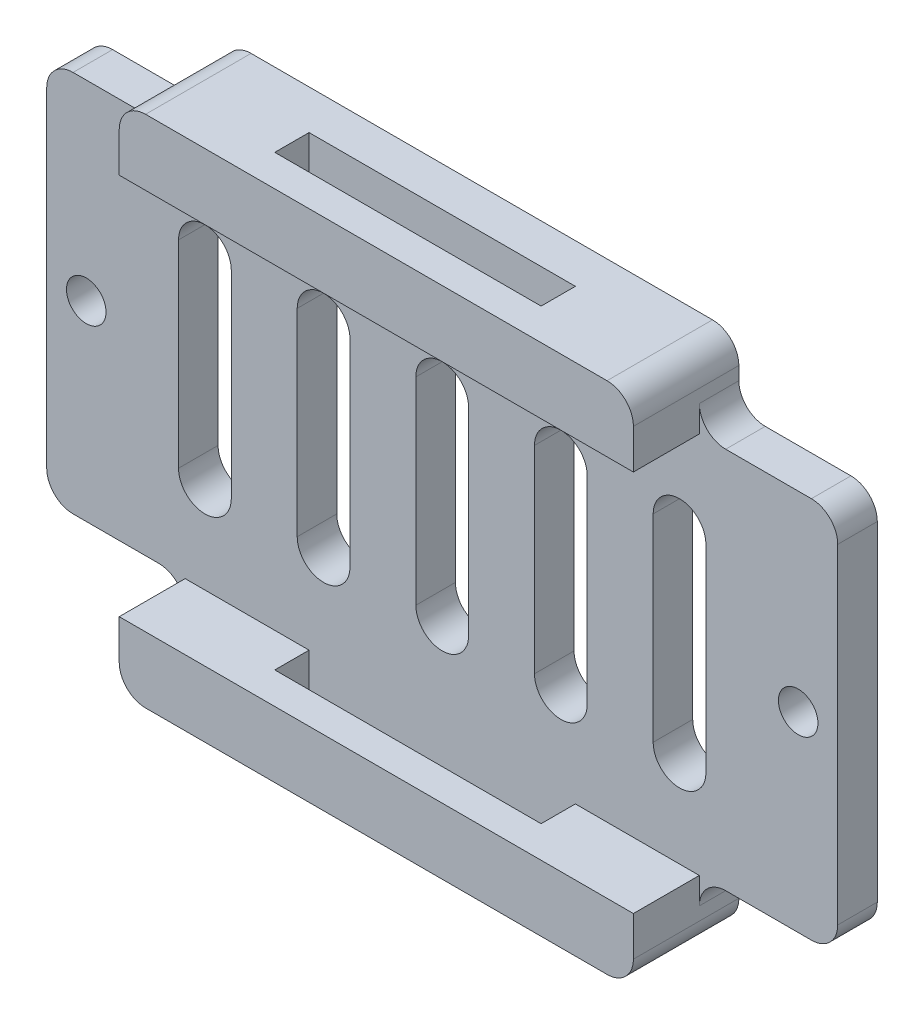
from build123d import *

# Parameters (mm, degrees)
SKETCH_2_W          = 39
SKETCH_2_H          = 5
EXTRUDE_1_DEPTH     = 8
SKETCH_3_W          = 60
SKETCH_3_H          = 3
EXTRUDE_2_DEPTH     = 29
SKETCH_4_W          = 20.2
SKETCH_4_H          = 2.6
CUT_EXTRUDE_1_DEPTH = 47.043457733
SKETCH_5_R          = 1.5
CUT_EXTRUDE_2_DEPTH = 10
FILLET_1_R          = 2
FILLET_2_R          = 2
SKETCH_6_W          = 39
SKETCH_6_H          = 3
EXTRUDE_3_DEPTH     = 5
SKETCH_7_W          = 39
SKETCH_7_H          = 5
EXTRUDE_4_DEPTH     = 5
SKETCH_8_W          = 20.2
SKETCH_8_H          = 2.6
CUT_EXTRUDE_3_DEPTH = 5
FILLET_3_R          = 2
CUT_EXTRUDE_4_DEPTH = 5


with BuildPart() as part:
    # 草图2 → 凸台-拉伸1 (new body)
    with BuildSketch(Plane.XY):
        Rectangle(SKETCH_2_W, SKETCH_2_H)
    extrude(amount=EXTRUDE_1_DEPTH)

    # 草图3 → 凸台-拉伸2 (add)
    with BuildSketch(Plane(origin=(0, 2.5, 0), x_dir=(1, 0, 0), z_dir=(0, 1, 0))):
        with Locations((0, -1.5)):
            Rectangle(SKETCH_3_W, SKETCH_3_H)
    extrude(amount=EXTRUDE_2_DEPTH)

    # 草图4 → 切除-拉伸1 (cut, through all)
    with BuildSketch(Plane.XZ.offset(2.5)):
        with Locations((0, 4.3)):
            Rectangle(SKETCH_4_W, SKETCH_4_H)
    extrude(amount=-CUT_EXTRUDE_1_DEPTH, mode=Mode.SUBTRACT)

    # 草图5 → 切除-拉伸2 (cut)
    with BuildSketch(Plane(origin=(0, 0, 0), x_dir=(-1, 0, 0), z_dir=(0, 0, -1))):
        with Locations((-27, 17)):
            Circle(SKETCH_5_R)
        with Locations((27, 17)):
            Circle(SKETCH_5_R)
    extrude(amount=-CUT_EXTRUDE_2_DEPTH, mode=Mode.SUBTRACT)

    # 圆角1
    fillet_1_edges = [part.edges().sort_by_distance(p)[0] for p in [
        (-30, 2.5, 1.5),
        (30, 2.5, 1.5),
        (-30, 31.5, 1.5),
        (30, 31.5, 1.5),
        (19.5, -2.5, 4),
        (-19.5, -2.5, 4),
    ]]
    fillet(fillet_1_edges, radius=FILLET_1_R)

    # 圆角2
    fillet_2_edges = [part.edges().sort_by_distance(p)[0] for p in [
        (-19.5, 2.5, 1.5),
        (19.5, 2.5, 1.5),
    ]]
    fillet(fillet_2_edges, radius=FILLET_2_R)

    # 草图6 → 凸台-拉伸3 (add)
    with BuildSketch(Plane(origin=(0, 31.5, 0), x_dir=(1, 0, 0), z_dir=(0, 1, 0))):
        with Locations((0, -1.5)):
            Rectangle(SKETCH_6_W, SKETCH_6_H)
    extrude(amount=EXTRUDE_3_DEPTH)

    # 草图7 → 凸台-拉伸4 (add)
    with BuildSketch(Plane.XY.offset(3)):
        with Locations((0, 34)):
            Rectangle(SKETCH_7_W, SKETCH_7_H)
    extrude(amount=EXTRUDE_4_DEPTH)

    # 草图8 → 切除-拉伸3 (cut)
    with BuildSketch(Plane(origin=(0, 36.5, 0), x_dir=(1, 0, 0), z_dir=(0, 1, 0))):
        with Locations((0, -4.3)):
            Rectangle(SKETCH_8_W, SKETCH_8_H)
    extrude(amount=-CUT_EXTRUDE_3_DEPTH, mode=Mode.SUBTRACT)

    # 圆角3
    fillet_3_edges = [part.edges().sort_by_distance(p)[0] for p in [
        (-19.5, 31.5, 1.5),
        (19.5, 31.5, 1.5),
        (-19.5, 36.5, 4),
        (19.5, 36.5, 4),
    ]]
    fillet(fillet_3_edges, radius=FILLET_3_R)

    # 草图9 → 切除-拉伸4 (cut)
    with BuildSketch(Plane(origin=(0, 0, 0), x_dir=(-1, 0, 0), z_dir=(0, 0, -1))):
        with BuildLine():
            Line((2, 24.5), (2, 9.5))
            ThreePointArc((2, 9.5), (0, 7.5), (-2, 9.5))
            Line((-2, 9.5), (-2, 24.5))
            ThreePointArc((-2, 24.5), (0, 26.5), (2, 24.5))
        make_face()
        with BuildLine():
            Line((7, 24.5), (7, 9.5))
            ThreePointArc((7, 9.5), (9, 7.5), (11, 9.5))
            Line((11, 9.5), (11, 24.5))
            ThreePointArc((11, 24.5), (9, 26.5), (7, 24.5))
        make_face()
        with BuildLine():
            Line((16, 24.5), (16, 9.5))
            ThreePointArc((16, 9.5), (18, 7.5), (20, 9.5))
            Line((20, 9.5), (20, 24.5))
            ThreePointArc((20, 24.5), (18, 26.5), (16, 24.5))
        make_face()
        with BuildLine():
            Line((-11, 24.5), (-11, 9.5))
            ThreePointArc((-11, 9.5), (-9, 7.5), (-7, 9.5))
            Line((-7, 9.5), (-7, 24.5))
            ThreePointArc((-7, 24.5), (-9, 26.5), (-11, 24.5))
        make_face()
        with BuildLine():
            Line((-20, 24.5), (-20, 9.5))
            ThreePointArc((-20, 9.5), (-18, 7.5), (-16, 9.5))
            Line((-16, 9.5), (-16, 24.5))
            ThreePointArc((-16, 24.5), (-18, 26.5), (-20, 24.5))
        make_face()
    extrude(amount=-CUT_EXTRUDE_4_DEPTH, mode=Mode.SUBTRACT)


solid = part.part
